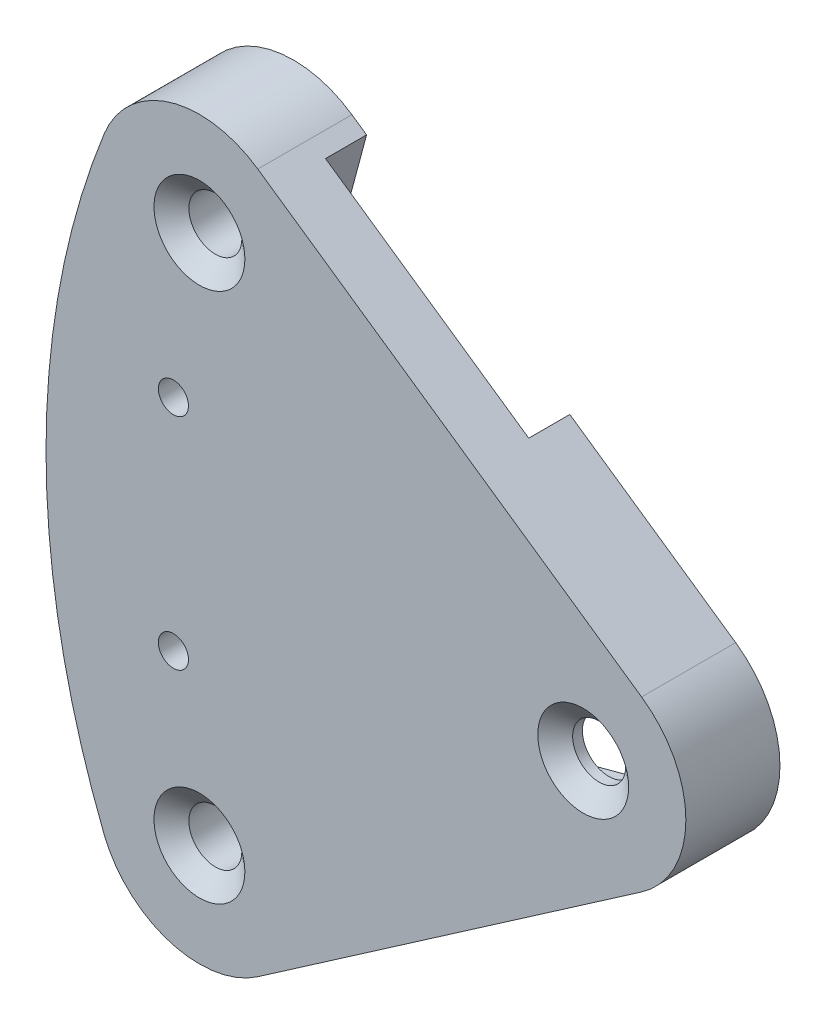
from build123d import *

# Parameters (mm, degrees)
BOSS_EXTRUDE1_DEPTH                               = 8.73125
SKETCH2_R                                         = 101.6
SKETCH2_R_2                                       = 76.2
CUT_EXTRUDE1_DEPTH                                = 58.485257961
FILLET1_R                                         = 9.525
CSK_FOR_8_FLAT_HEAD_MACHINE_SCREW_100_D           = 4.9149
CSK_FOR_8_FLAT_HEAD_MACHINE_SCREW_100_CSINK_D     = 8.4328
CSK_FOR_8_FLAT_HEAD_MACHINE_SCREW_100_CSINK_ANGLE = 100
CUT_EXTRUDE2_START                                = -6.35
CUT_EXTRUDE2_DEPTH                                = 6.35
CUT_EXTRUDE3_DEPTH                                = 3.81
SKETCH7_R                                         = 1.397
CUT_EXTRUDE4_DEPTH                                = 3.175
HOLE1_AT_2_COUNT                                  = 2
HOLE1_AT_2_PITCH                                  = 9.3599
HOLE1_AT_3_COUNT                                  = 2
HOLE1_AT_3_PITCH                                  = 38.818175673
HOLE1_AT_4_COUNT                                  = 2
HOLE1_AT_4_PITCH                                  = 40.17317123
F_2_CLEARANCE_HOLE1_D                             = 2.7051
F_2_CLEARANCE_HOLE1_DEPTH                         = 4.7625


with BuildPart() as part:
    # Sketch1 → Boss-Extrude1 (new body)
    with BuildSketch(Plane.XY):
        Polygon((33.299680929, 0), (-33.299680929, 46.0375), (-33.299680929, -46.0375), align=None)
    extrude(amount=BOSS_EXTRUDE1_DEPTH)

    # Sketch2 → Cut-Extrude1 (cut, through all)
    with BuildSketch(Plane.XY.offset(8.73125)):
        with Locations((42.900319071, 0)):
            Circle(SKETCH2_R)
        with Locations((42.900319071, 0)):
            Circle(SKETCH2_R_2, mode=Mode.SUBTRACT)
    extrude(amount=-CUT_EXTRUDE1_DEPTH, mode=Mode.SUBTRACT)

    # Fillet1
    fillet1_edges = [part.edges().sort_by_distance(p)[0] for p in [
        (-22.72460624, -38.727369881, 4.365625),
        (-22.72460624, 38.727369881, 4.365625),
        (33.299680929, 0, 4.365625),
    ]]
    fillet(fillet1_edges, radius=FILLET1_R)

    # CSK for #8 Flat Head Machine Screw (100)1 (through all)
    with Locations(Plane.XY.offset(8.73125)):
        with Locations((-19.063658953, -24.617494846), (-19.063658953, 24.617494846), (16.54881886, 0)):
            CounterSinkHole(CSK_FOR_8_FLAT_HEAD_MACHINE_SCREW_100_D / 2, CSK_FOR_8_FLAT_HEAD_MACHINE_SCREW_100_CSINK_D / 2, counter_sink_angle=CSK_FOR_8_FLAT_HEAD_MACHINE_SCREW_100_CSINK_ANGLE)

    # Sketch5 → Cut-Extrude2 (cut)
    with BuildSketch(Plane(origin=(0, 0, 0), x_dir=(-1, 0, 0), z_dir=(0, 0, -1)).offset(CUT_EXTRUDE2_START)):
        with BuildLine():
            Line((30.823542048, 19.267389595), (-18.192319797, 6.133628997))
            ThreePointArc((-18.192319797, 6.133628997), (-22.89881886, 0), (-18.192319797, -6.133628997))
            Line((-18.192319797, -6.133628997), (30.823542048, -19.267389595))
            ThreePointArc((30.823542048, -19.267389595), (33.299680929, 0), (30.823542048, 19.267389595))
        make_face()
    extrude(amount=CUT_EXTRUDE2_DEPTH, mode=Mode.SUBTRACT)

    # Sketch6 → Cut-Extrude3 (cut)
    with BuildSketch(Plane(origin=(0, 0, 0), x_dir=(-1, 0, 0), z_dir=(0, 0, -1))):
        Polygon((16.588726313, -15.453182214), (-4.265612277, -9.86527903), (-8.867414899, -27.039440222), (11.986923691, -32.627343405), align=None)
        Polygon((11.986923691, 32.627343405), (-8.867414899, 27.039440222), (-4.265612277, 9.86527903), (16.588726313, 15.453182214), align=None)
    extrude(amount=-CUT_EXTRUDE3_DEPTH, mode=Mode.SUBTRACT)

    # Sketch7 → Cut-Extrude4 (cut)
    with BuildSketch(Plane(origin=(0, 0, 6.35), x_dir=(-1, 0, 0), z_dir=(0, 0, -1))):
        with Locations((21.479680921, -10.189705806)):
            Circle(SKETCH7_R)
        with Locations((21.479680921, 10.189705806)):
            Circle(SKETCH7_R)
    extrude(amount=-CUT_EXTRUDE4_DEPTH, mode=Mode.SUBTRACT)

    # Sketch9 → Hole1 (revolve, cut)
    with BuildSketch(Plane(origin=(-8.904685942, -20.086585615, 3.81), x_dir=(0, 1, 0), z_dir=(1, 0, 0))):
        Polygon((0, 0), (0, 2.921), (1.4986, 2.921), (1.6383, 0), align=None)
    hole1 = revolve(axis=Axis((-8.904685942, -20.086585615, 113.81), (0, 0, -1)), mode=Mode.SUBTRACT)

    # Hole1 at 2: Hole1 ×2
    with Locations(*[Vector(0.9659258262890683, 0.25881904510252096, 0) * (i * HOLE1_AT_2_PITCH) for i in range(1, HOLE1_AT_2_COUNT)]):
        add(hole1, mode=Mode.SUBTRACT)

    # Hole1 at 3: Hole1 ×2
    with Locations(*[Vector(0.23290556510295454, 0.9724993561664057, 0) * (i * HOLE1_AT_3_PITCH) for i in range(1, HOLE1_AT_3_COUNT)]):
        add(hole1, mode=Mode.SUBTRACT)

    # Hole1 at 4: Hole1 ×2
    with Locations(*[(0, i * HOLE1_AT_4_PITCH, 0) for i in range(1, HOLE1_AT_4_COUNT)]):
        add(hole1, mode=Mode.SUBTRACT)

    # #2 Clearance Hole1
    with Locations(Plane(origin=(0, 0, 3.81), x_dir=(-1, 0, 0), z_dir=(0, 0, -1))):
        with Locations((8.904685942, -20.086585615), (-0.136283199, -17.664065235), (-0.136283199, 17.664065235), (8.904685942, 20.086585615)):
            Hole(F_2_CLEARANCE_HOLE1_D / 2, depth=F_2_CLEARANCE_HOLE1_DEPTH)


solid = part.part
